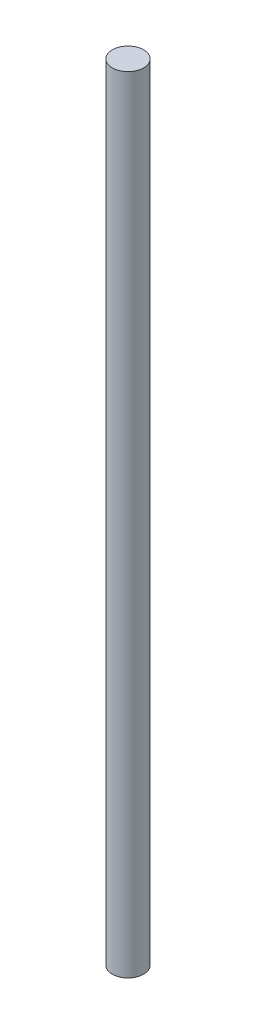
from build123d import *

# Parameters (mm, degrees)
SKETCH1_R           = 6
BOSS_EXTRUDE1_DEPTH = 150


with BuildPart() as part:
    # Sketch1 → Boss-Extrude1 (new, symmetric)
    with BuildSketch(Plane(origin=(0, 0, 0), x_dir=(1, 0, 0), z_dir=(0, 1, 0))):
        with Locations(Location((0, 0, 0), (0, 0, 270))):
            Circle(SKETCH1_R)
    extrude(amount=BOSS_EXTRUDE1_DEPTH, both=True)


solid = part.part
